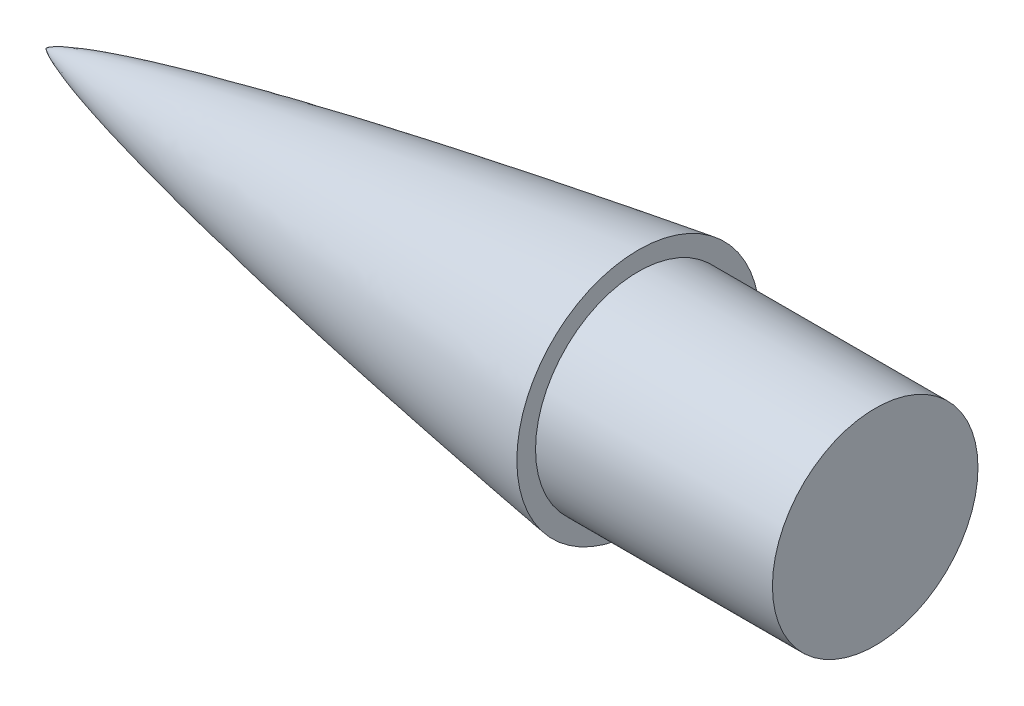
from build123d import *

# Parameters (mm, degrees)
SKETCH2_R           = 11.021474984
BOSS_EXTRUDE1_DEPTH = 25.4


with BuildPart() as part:
    # Sketch1 → Revolve1 (revolve)
    with BuildSketch(Plane.XY):
        with BuildLine():
            Line((0, 0), (63.5, 0))
            Line((63.5, 0), (63.5, 13.028074984))
            add(Edge.make_bspline(
                [(0, 0), (0.002336833, 0.006261243), (0.008449108, 0.018018878), (0.024282699, 0.03707865), (0.049301381, 0.062528261), (0.08285746, 0.091694078), (0.130092662, 0.128429562), (0.198903613, 0.176633842), (0.30891132, 0.245881724), (0.489853363, 0.347787552), (0.801272327, 0.503404043), (1.344136271, 0.742812456), (2.303049814, 1.112670534), (3.919864292, 1.656956496), (6.546639289, 2.429833778), (10.068878534, 3.343191013), (14.305527269, 4.334349194), (18.946313889, 5.336202581), (23.628097401, 6.283524727), (28.273967135, 7.178106017), (32.999382683, 8.046293889), (37.611964806, 8.865298109), (42.423650353, 9.686589349), (46.919606109, 10.436239642), (51.945798569, 11.244109234), (56.103593098, 11.902196623), (60.304657925, 12.545344223), (62.429235615, 12.867169996), (63.5, 13.028074984)],
                knots=[0, 0, 0, 0, 0, 0.000372793, 0.000745586, 0.001374859, 0.002003335, 0.00285942, 0.004097636, 0.006081541, 0.009280173, 0.014497358, 0.02358268, 0.039337108, 0.06679986, 0.110142427, 0.176804124, 0.243465828, 0.310127525, 0.376789225, 0.443450925, 0.510112626, 0.576774327, 0.643436027, 0.710097727, 0.776759427, 0.843421128, 0.910082828, 0.910082828, 0.910082828, 0.910082828, 0.910082828], degree=4))
        make_face()
    revolve(axis=Axis((0, 0, 0), (1, 0, 0)))

    # Sketch2 → Boss-Extrude1 (add)
    with BuildSketch(Plane(origin=(63.5, 0, 0), x_dir=(0, 0, -1), z_dir=(1, 0, 0))):
        with Locations(Location((0, 0, 0), (0, 0, 180))):
            Circle(SKETCH2_R)
    extrude(amount=BOSS_EXTRUDE1_DEPTH)


solid = part.part
